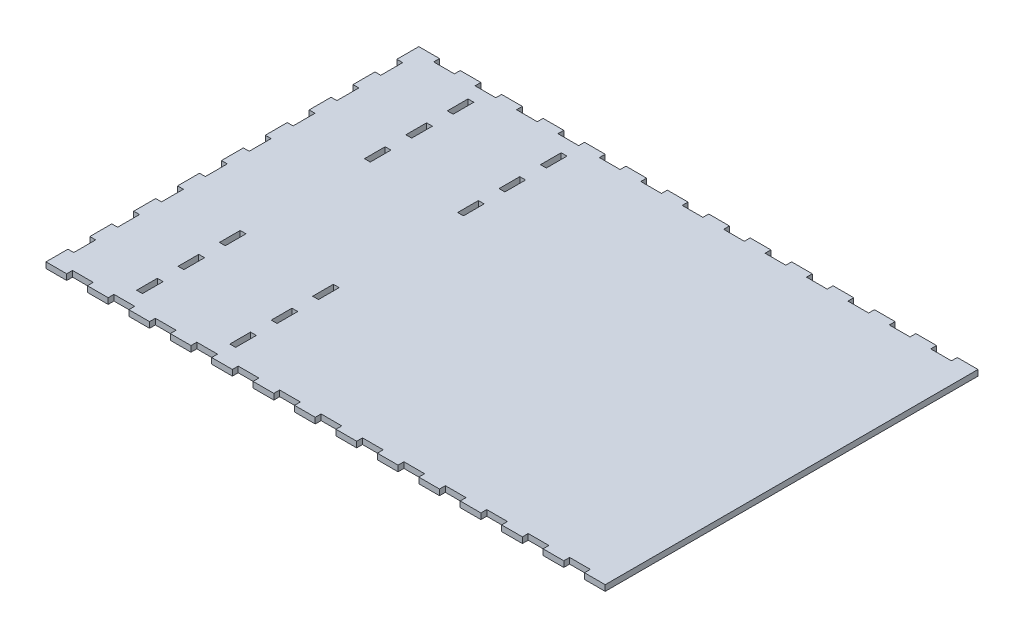
from build123d import *

# Parameters (mm, degrees)
SKETCH16_W                 = 304.8
SKETCH16_H                 = 203.2
BOSS_EXTRUDE4_DEPTH        = 3.175
SKETCH17_W                 = 11.288888889
SKETCH17_H                 = 3.175
CUT_EXTRUDE6_DEPTH         = 3.18
LPATTERN19_COUNT           = 14
LPATTERN19_PITCH           = 22.577777778
MIRROR3_COPY_1_SKETCH_W    = 11.288888889
MIRROR3_COPY_1_SKETCH_H    = 3.175
MIRROR3_COPY_1_DEPTH       = 3.18
MIRROR3_COPY_2_SKETCH_W    = 11.288888889
MIRROR3_COPY_2_SKETCH_H    = 3.175
MIRROR3_COPY_2_DEPTH       = 3.18
MIRROR3_COPY_3_SKETCH_W    = 11.288888889
MIRROR3_COPY_3_SKETCH_H    = 3.175
MIRROR3_COPY_3_DEPTH       = 3.18
MIRROR3_COPY_4_SKETCH_W    = 11.288888889
MIRROR3_COPY_4_SKETCH_H    = 3.175
MIRROR3_COPY_4_DEPTH       = 3.18
MIRROR3_COPY_5_SKETCH_W    = 11.288888889
MIRROR3_COPY_5_SKETCH_H    = 3.175
MIRROR3_COPY_5_DEPTH       = 3.18
MIRROR3_COPY_6_SKETCH_W    = 11.288888889
MIRROR3_COPY_6_SKETCH_H    = 3.175
MIRROR3_COPY_6_DEPTH       = 3.18
MIRROR3_COPY_7_SKETCH_W    = 11.288888889
MIRROR3_COPY_7_SKETCH_H    = 3.175
MIRROR3_COPY_7_DEPTH       = 3.18
MIRROR3_COPY_8_SKETCH_W    = 11.288888889
MIRROR3_COPY_8_SKETCH_H    = 3.175
MIRROR3_COPY_8_DEPTH       = 3.18
MIRROR3_COPY_9_SKETCH_W    = 11.288888889
MIRROR3_COPY_9_SKETCH_H    = 3.175
MIRROR3_COPY_9_DEPTH       = 3.18
MIRROR3_COPY_10_SKETCH_W   = 11.288888889
MIRROR3_COPY_10_SKETCH_H   = 3.175
MIRROR3_COPY_10_DEPTH      = 3.18
MIRROR3_COPY_11_SKETCH_W   = 11.288888889
MIRROR3_COPY_11_SKETCH_H   = 3.175
MIRROR3_COPY_11_DEPTH      = 3.18
MIRROR3_COPY_12_SKETCH_W   = 11.288888889
MIRROR3_COPY_12_SKETCH_H   = 3.175
MIRROR3_COPY_12_DEPTH      = 3.18
MIRROR3_COPY_13_SKETCH_W   = 11.288888889
MIRROR3_COPY_13_SKETCH_H   = 3.175
MIRROR3_COPY_13_DEPTH      = 3.18
SKETCH21_W                 = 3.175
SKETCH21_H                 = 11.952941177
CUT_EXTRUDE7_DEPTH         = 3.18
LPATTERN20_COUNT           = 9
LPATTERN20_PITCH           = 23.905882353
SKETCH23_W                 = 3.175
SKETCH23_H                 = 11.288888889
CUT_EXTRUDE8_DEPTH         = 3.18
LPATTERN21_COUNT           = 3
LPATTERN21_PITCH           = 22.577777778
LPATTERN22_COUNT           = 2
LPATTERN22_PITCH           = 50.8
LPATTERN22_COPY_1_SKETCH_W = 3.175
LPATTERN22_COPY_1_SKETCH_H = 11.288888889
LPATTERN22_COPY_1_DEPTH    = 3.18
LPATTERN22_COPY_2_SKETCH_W = 3.175
LPATTERN22_COPY_2_SKETCH_H = 11.288888889
LPATTERN22_COPY_2_DEPTH    = 3.18
MIRROR4_COPY_1_SKETCH_W    = 3.175
MIRROR4_COPY_1_SKETCH_H    = 11.288888889
MIRROR4_COPY_1_DEPTH       = 3.18
MIRROR4_COPY_2_SKETCH_W    = 3.175
MIRROR4_COPY_2_SKETCH_H    = 11.288888889
MIRROR4_COPY_2_DEPTH       = 3.18
MIRROR4_COPY_3_SKETCH_W    = 3.175
MIRROR4_COPY_3_SKETCH_H    = 11.288888889
MIRROR4_COPY_3_DEPTH       = 3.18
MIRROR4_COPY_4_SKETCH_W    = 3.175
MIRROR4_COPY_4_SKETCH_H    = 11.288888889
MIRROR4_COPY_4_DEPTH       = 3.18
MIRROR4_COPY_5_SKETCH_W    = 3.175
MIRROR4_COPY_5_SKETCH_H    = 11.288888889
MIRROR4_COPY_5_DEPTH       = 3.18


with BuildPart() as part:
    # Sketch16 → Boss-Extrude4 (new body)
    with BuildSketch(Plane(origin=(0, 0, 0), x_dir=(1, 0, 0), z_dir=(0, 1, 0))):
        Rectangle(SKETCH16_W, SKETCH16_H)
    extrude(amount=BOSS_EXTRUDE4_DEPTH)

    # Sketch17 → Cut-Extrude6 (cut)
    with BuildSketch(Plane(origin=(0, 3.175, 0), x_dir=(1, 0, 0), z_dir=(0, 1, 0))):
        with Locations((-135.466666667, 100.0125)):
            Rectangle(SKETCH17_W, SKETCH17_H)
    cut_extrude6 = extrude(amount=-CUT_EXTRUDE6_DEPTH, mode=Mode.SUBTRACT)

    # LPattern19: Cut-Extrude6 ×14
    with Locations(*[(i * LPATTERN19_PITCH, 0, 0) for i in range(1, LPATTERN19_COUNT)]):
        add(cut_extrude6, mode=Mode.SUBTRACT)

    # Mirror3: Cut-Extrude6 across plane
    add(cut_extrude6.mirror(Plane.XY), mode=Mode.SUBTRACT)

    # Mirror3 copy 1 sketch → Mirror3 copy 1 (cut)
    with BuildSketch(Plane(origin=(22.577777778, 3.175, 0), x_dir=(1, 0, 0), z_dir=(0, 1, 0))):
        with Locations((-135.466666667, -100.0125)):
            Rectangle(MIRROR3_COPY_1_SKETCH_W, MIRROR3_COPY_1_SKETCH_H)
    extrude(amount=-MIRROR3_COPY_1_DEPTH, mode=Mode.SUBTRACT)

    # Mirror3 copy 2 sketch → Mirror3 copy 2 (cut)
    with BuildSketch(Plane(origin=(45.155555556, 3.175, 0), x_dir=(1, 0, 0), z_dir=(0, 1, 0))):
        with Locations((-135.466666667, -100.0125)):
            Rectangle(MIRROR3_COPY_2_SKETCH_W, MIRROR3_COPY_2_SKETCH_H)
    extrude(amount=-MIRROR3_COPY_2_DEPTH, mode=Mode.SUBTRACT)

    # Mirror3 copy 3 sketch → Mirror3 copy 3 (cut)
    with BuildSketch(Plane(origin=(67.733333333, 3.175, 0), x_dir=(1, 0, 0), z_dir=(0, 1, 0))):
        with Locations((-135.466666667, -100.0125)):
            Rectangle(MIRROR3_COPY_3_SKETCH_W, MIRROR3_COPY_3_SKETCH_H)
    extrude(amount=-MIRROR3_COPY_3_DEPTH, mode=Mode.SUBTRACT)

    # Mirror3 copy 4 sketch → Mirror3 copy 4 (cut)
    with BuildSketch(Plane(origin=(90.311111111, 3.175, 0), x_dir=(1, 0, 0), z_dir=(0, 1, 0))):
        with Locations((-135.466666667, -100.0125)):
            Rectangle(MIRROR3_COPY_4_SKETCH_W, MIRROR3_COPY_4_SKETCH_H)
    extrude(amount=-MIRROR3_COPY_4_DEPTH, mode=Mode.SUBTRACT)

    # Mirror3 copy 5 sketch → Mirror3 copy 5 (cut)
    with BuildSketch(Plane(origin=(112.888888889, 3.175, 0), x_dir=(1, 0, 0), z_dir=(0, 1, 0))):
        with Locations((-135.466666667, -100.0125)):
            Rectangle(MIRROR3_COPY_5_SKETCH_W, MIRROR3_COPY_5_SKETCH_H)
    extrude(amount=-MIRROR3_COPY_5_DEPTH, mode=Mode.SUBTRACT)

    # Mirror3 copy 6 sketch → Mirror3 copy 6 (cut)
    with BuildSketch(Plane(origin=(135.466666667, 3.175, 0), x_dir=(1, 0, 0), z_dir=(0, 1, 0))):
        with Locations((-135.466666667, -100.0125)):
            Rectangle(MIRROR3_COPY_6_SKETCH_W, MIRROR3_COPY_6_SKETCH_H)
    extrude(amount=-MIRROR3_COPY_6_DEPTH, mode=Mode.SUBTRACT)

    # Mirror3 copy 7 sketch → Mirror3 copy 7 (cut)
    with BuildSketch(Plane(origin=(158.044444444, 3.175, 0), x_dir=(1, 0, 0), z_dir=(0, 1, 0))):
        with Locations((-135.466666667, -100.0125)):
            Rectangle(MIRROR3_COPY_7_SKETCH_W, MIRROR3_COPY_7_SKETCH_H)
    extrude(amount=-MIRROR3_COPY_7_DEPTH, mode=Mode.SUBTRACT)

    # Mirror3 copy 8 sketch → Mirror3 copy 8 (cut)
    with BuildSketch(Plane(origin=(180.622222222, 3.175, 0), x_dir=(1, 0, 0), z_dir=(0, 1, 0))):
        with Locations((-135.466666667, -100.0125)):
            Rectangle(MIRROR3_COPY_8_SKETCH_W, MIRROR3_COPY_8_SKETCH_H)
    extrude(amount=-MIRROR3_COPY_8_DEPTH, mode=Mode.SUBTRACT)

    # Mirror3 copy 9 sketch → Mirror3 copy 9 (cut)
    with BuildSketch(Plane(origin=(203.2, 3.175, 0), x_dir=(1, 0, 0), z_dir=(0, 1, 0))):
        with Locations((-135.466666667, -100.0125)):
            Rectangle(MIRROR3_COPY_9_SKETCH_W, MIRROR3_COPY_9_SKETCH_H)
    extrude(amount=-MIRROR3_COPY_9_DEPTH, mode=Mode.SUBTRACT)

    # Mirror3 copy 10 sketch → Mirror3 copy 10 (cut)
    with BuildSketch(Plane(origin=(225.777777778, 3.175, 0), x_dir=(1, 0, 0), z_dir=(0, 1, 0))):
        with Locations((-135.466666667, -100.0125)):
            Rectangle(MIRROR3_COPY_10_SKETCH_W, MIRROR3_COPY_10_SKETCH_H)
    extrude(amount=-MIRROR3_COPY_10_DEPTH, mode=Mode.SUBTRACT)

    # Mirror3 copy 11 sketch → Mirror3 copy 11 (cut)
    with BuildSketch(Plane(origin=(248.355555556, 3.175, 0), x_dir=(1, 0, 0), z_dir=(0, 1, 0))):
        with Locations((-135.466666667, -100.0125)):
            Rectangle(MIRROR3_COPY_11_SKETCH_W, MIRROR3_COPY_11_SKETCH_H)
    extrude(amount=-MIRROR3_COPY_11_DEPTH, mode=Mode.SUBTRACT)

    # Mirror3 copy 12 sketch → Mirror3 copy 12 (cut)
    with BuildSketch(Plane(origin=(270.933333333, 3.175, 0), x_dir=(1, 0, 0), z_dir=(0, 1, 0))):
        with Locations((-135.466666667, -100.0125)):
            Rectangle(MIRROR3_COPY_12_SKETCH_W, MIRROR3_COPY_12_SKETCH_H)
    extrude(amount=-MIRROR3_COPY_12_DEPTH, mode=Mode.SUBTRACT)

    # Mirror3 copy 13 sketch → Mirror3 copy 13 (cut)
    with BuildSketch(Plane(origin=(293.511111111, 3.175, 0), x_dir=(1, 0, 0), z_dir=(0, 1, 0))):
        with Locations((-135.466666667, -100.0125)):
            Rectangle(MIRROR3_COPY_13_SKETCH_W, MIRROR3_COPY_13_SKETCH_H)
    extrude(amount=-MIRROR3_COPY_13_DEPTH, mode=Mode.SUBTRACT)

    # Sketch21 → Cut-Extrude7 (cut)
    with BuildSketch(Plane(origin=(0, 3.175, 0), x_dir=(1, 0, 0), z_dir=(0, 1, 0))):
        with Locations((-150.8125, -83.670588236)):
            Rectangle(SKETCH21_W, SKETCH21_H)
    cut_extrude7 = extrude(amount=-CUT_EXTRUDE7_DEPTH, mode=Mode.SUBTRACT)

    # LPattern20: Cut-Extrude7 ×9
    with Locations(*[(0, 0, -i * LPATTERN20_PITCH) for i in range(1, LPATTERN20_COUNT)]):
        add(cut_extrude7, mode=Mode.SUBTRACT)

    # Sketch23 → Cut-Extrude8 (cut)
    with BuildSketch(Plane(origin=(0, 3.175, 0), x_dir=(1, 0, 0), z_dir=(0, 1, 0))):
        with Locations((-112.7125, -84.666666667)):
            Rectangle(SKETCH23_W, SKETCH23_H)
    cut_extrude8 = extrude(amount=-CUT_EXTRUDE8_DEPTH, mode=Mode.SUBTRACT)

    # LPattern21: Cut-Extrude8 ×3
    with Locations(*[(0, 0, -i * LPATTERN21_PITCH) for i in range(1, LPATTERN21_COUNT)]):
        add(cut_extrude8, mode=Mode.SUBTRACT)

    # LPattern22: Cut-Extrude8 ×2
    with Locations(*[(i * LPATTERN22_PITCH, 0, 0) for i in range(1, LPATTERN22_COUNT)]):
        add(cut_extrude8, mode=Mode.SUBTRACT)

    # LPattern22 copy 1 sketch → LPattern22 copy 1 (cut)
    with BuildSketch(Plane(origin=(50.8, 3.175, -22.577777778), x_dir=(1, 0, 0), z_dir=(0, 1, 0))):
        with Locations((-112.7125, -84.666666667)):
            Rectangle(LPATTERN22_COPY_1_SKETCH_W, LPATTERN22_COPY_1_SKETCH_H)
    extrude(amount=-LPATTERN22_COPY_1_DEPTH, mode=Mode.SUBTRACT)

    # LPattern22 copy 2 sketch → LPattern22 copy 2 (cut)
    with BuildSketch(Plane(origin=(50.8, 3.175, -45.155555556), x_dir=(1, 0, 0), z_dir=(0, 1, 0))):
        with Locations((-112.7125, -84.666666667)):
            Rectangle(LPATTERN22_COPY_2_SKETCH_W, LPATTERN22_COPY_2_SKETCH_H)
    extrude(amount=-LPATTERN22_COPY_2_DEPTH, mode=Mode.SUBTRACT)

    # Mirror4: Cut-Extrude8 across plane
    add(cut_extrude8.mirror(Plane.XY), mode=Mode.SUBTRACT)

    # Mirror4 copy 1 sketch → Mirror4 copy 1 (cut)
    with BuildSketch(Plane(origin=(0, 3.175, 22.577777778), x_dir=(1, 0, 0), z_dir=(0, 1, 0))):
        with Locations((-112.7125, 84.666666667)):
            Rectangle(MIRROR4_COPY_1_SKETCH_W, MIRROR4_COPY_1_SKETCH_H)
    extrude(amount=-MIRROR4_COPY_1_DEPTH, mode=Mode.SUBTRACT)

    # Mirror4 copy 2 sketch → Mirror4 copy 2 (cut)
    with BuildSketch(Plane(origin=(0, 3.175, 45.155555556), x_dir=(1, 0, 0), z_dir=(0, 1, 0))):
        with Locations((-112.7125, 84.666666667)):
            Rectangle(MIRROR4_COPY_2_SKETCH_W, MIRROR4_COPY_2_SKETCH_H)
    extrude(amount=-MIRROR4_COPY_2_DEPTH, mode=Mode.SUBTRACT)

    # Mirror4 copy 3 sketch → Mirror4 copy 3 (cut)
    with BuildSketch(Plane(origin=(50.8, 3.175, 0), x_dir=(1, 0, 0), z_dir=(0, 1, 0))):
        with Locations((-112.7125, 84.666666667)):
            Rectangle(MIRROR4_COPY_3_SKETCH_W, MIRROR4_COPY_3_SKETCH_H)
    extrude(amount=-MIRROR4_COPY_3_DEPTH, mode=Mode.SUBTRACT)

    # Mirror4 copy 4 sketch → Mirror4 copy 4 (cut)
    with BuildSketch(Plane(origin=(50.8, 3.175, 22.577777778), x_dir=(1, 0, 0), z_dir=(0, 1, 0))):
        with Locations((-112.7125, 84.666666667)):
            Rectangle(MIRROR4_COPY_4_SKETCH_W, MIRROR4_COPY_4_SKETCH_H)
    extrude(amount=-MIRROR4_COPY_4_DEPTH, mode=Mode.SUBTRACT)

    # Mirror4 copy 5 sketch → Mirror4 copy 5 (cut)
    with BuildSketch(Plane(origin=(50.8, 3.175, 45.155555556), x_dir=(1, 0, 0), z_dir=(0, 1, 0))):
        with Locations((-112.7125, 84.666666667)):
            Rectangle(MIRROR4_COPY_5_SKETCH_W, MIRROR4_COPY_5_SKETCH_H)
    extrude(amount=-MIRROR4_COPY_5_DEPTH, mode=Mode.SUBTRACT)


solid = part.part
